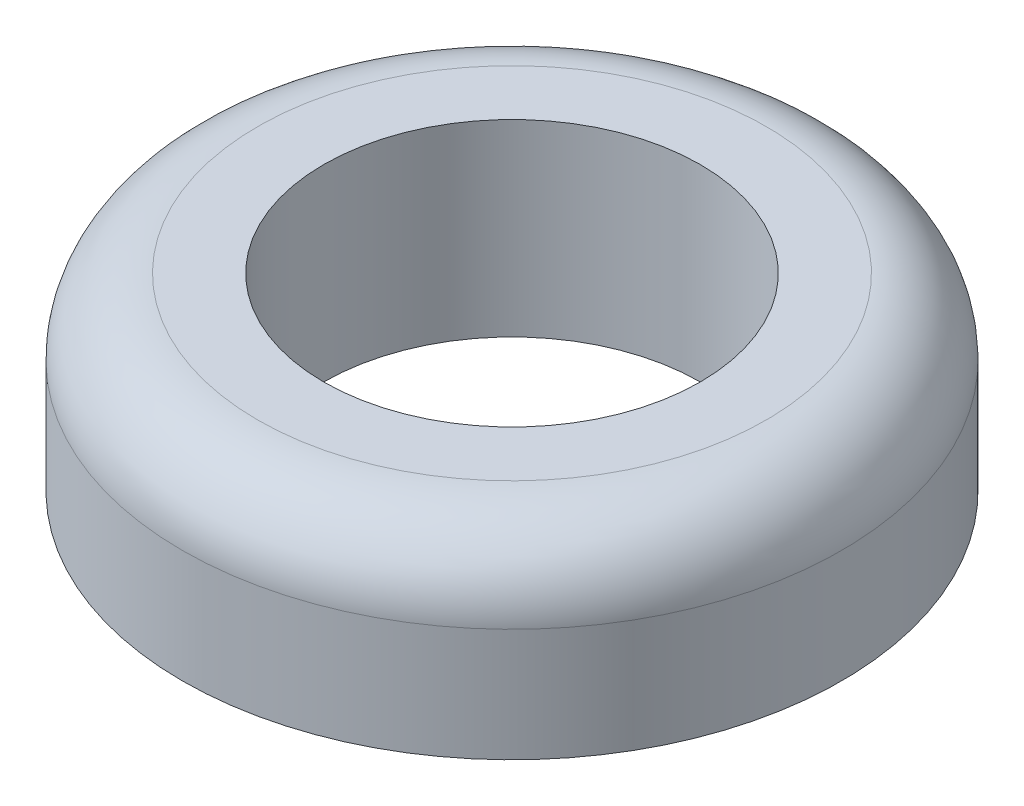
from build123d import *

# Parameters (mm, degrees)
SKETCH1_R           = 1.75
SKETCH1_R_2         = 1
BOSS_EXTRUDE1_DEPTH = 1
FILLET1_R           = 0.4


with BuildPart() as part:
    # Sketch1 → Boss-Extrude1 (new body)
    with BuildSketch(Plane(origin=(0, 0, 0), x_dir=(1, 0, 0), z_dir=(0, 1, 0))):
        with Locations(Location((0, 0, 0), (0, 0, 270))):
            Circle(SKETCH1_R)
        with Locations(Location((0, 0, 0), (0, 0, 270))):
            Circle(SKETCH1_R_2, mode=Mode.SUBTRACT)
    extrude(amount=BOSS_EXTRUDE1_DEPTH)

    # Fillet1
    fillet1_edges = [part.edges().sort_by_distance(p)[0] for p in [
        (0, 1, -1.75),
    ]]
    fillet(fillet1_edges, radius=FILLET1_R)


solid = part.part
